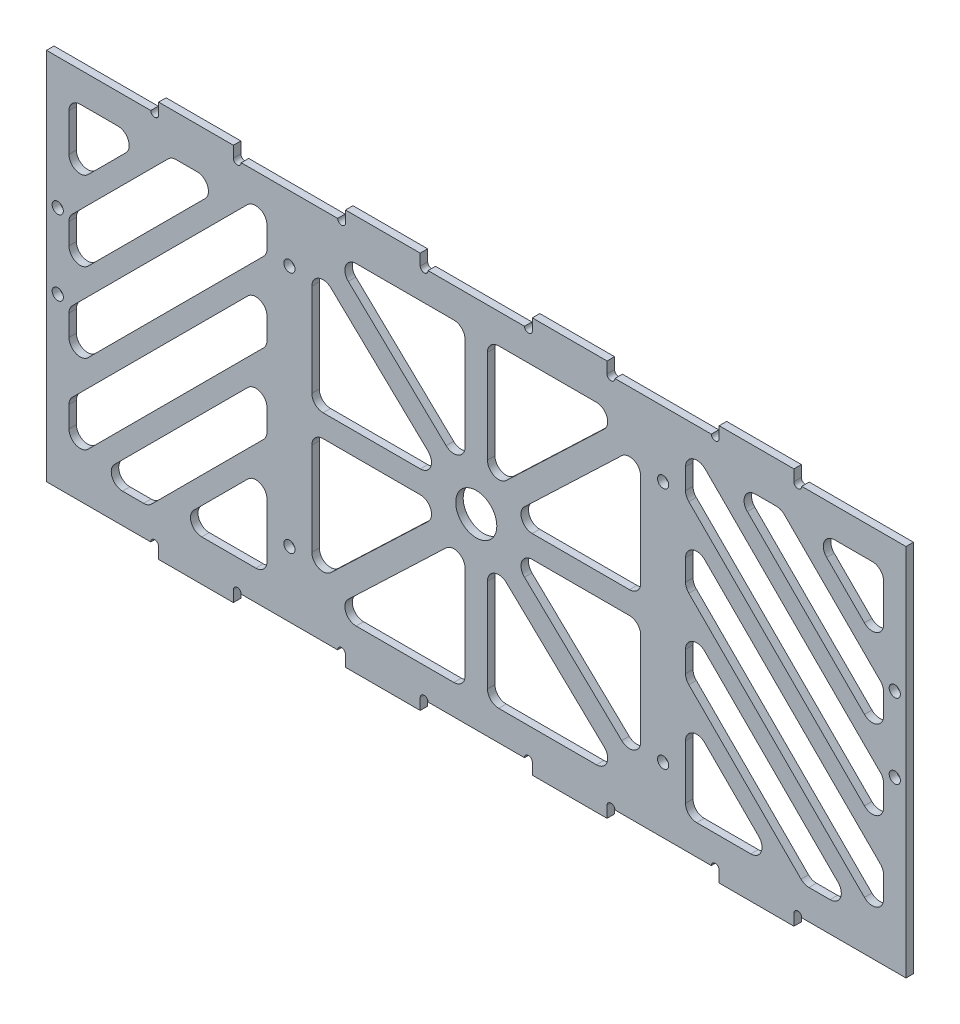
from build123d import *

# Parameters (mm, degrees)
SKETCH_1_W           = 230
SKETCH_1_H           = 100
EXTRUDE_1_DEPTH      = 2
SKETCH_5_R           = 1.5
CUT_EXTRUDE_3_DEPTH  = 2
SKETCH_6_W           = 70
SKETCH_6_H           = 6
EXTRUDE_3_DEPTH      = 2
SKETCH_7_R           = 1.05
CUT_EXTRUDE_4_DEPTH  = 2
SKETCH_10_W          = 20
SKETCH_10_H          = 6
EXTRUDE_5_DEPTH      = 2
SKETCH_11_R          = 1.05
CUT_EXTRUDE_6_DEPTH  = 2
SKETCH_14_W          = 30
SKETCH_14_H          = 6
CUT_EXTRUDE_9_DEPTH  = 2
SKETCH_15_R          = 1.05
CUT_EXTRUDE_10_DEPTH = 2
CUT_EXTRUDE_11_DEPTH = 40
CUT_EXTRUDE_12_DEPTH = 40
FILLET_1_R           = 3
SKETCH_18_R          = 5.5
CUT_EXTRUDE_13_DEPTH = 40
SKETCH_23_R          = 1.5
CUT_EXTRUDE_17_DEPTH = 10


with BuildPart() as part:
    # 草图1 → 凸台-拉伸1 (new body)
    with BuildSketch(Plane.XY):
        Rectangle(SKETCH_1_W, SKETCH_1_H)
    extrude(amount=EXTRUDE_1_DEPTH)

    # 草图5 → 切除-拉伸3 (cut)
    with BuildSketch(Plane(origin=(0, 0, 0), x_dir=(-1, 0, 0), z_dir=(0, 0, -1))):
        with Locations((50, -32.5)):
            Circle(SKETCH_5_R)
        with Locations((50, 32.5)):
            Circle(SKETCH_5_R)
        with Locations((-50, -32.5)):
            Circle(SKETCH_5_R)
        with Locations((-50, 32.5)):
            Circle(SKETCH_5_R)
    extrude(amount=-CUT_EXTRUDE_3_DEPTH, mode=Mode.SUBTRACT)

    # 草图6 → 凸台-拉伸3 (add)
    with BuildSketch(Plane.XY.offset(2)):
        with Locations((0, 50)):
            Rectangle(SKETCH_6_W, SKETCH_6_H)
        with Locations((0, -50)):
            Rectangle(SKETCH_6_W, SKETCH_6_H)
    extrude(amount=-EXTRUDE_3_DEPTH)

    # 草图7 → 切除-拉伸4 (cut)
    with BuildSketch(Plane.XY.offset(2)):
        with Locations((36.05, 50)):
            Circle(SKETCH_7_R)
        with Locations((-36.05, 50)):
            Circle(SKETCH_7_R)
        with Locations((-36.05, -50)):
            Circle(SKETCH_7_R)
        with Locations((36.05, -50)):
            Circle(SKETCH_7_R)
    extrude(amount=-CUT_EXTRUDE_4_DEPTH, mode=Mode.SUBTRACT)

    # 草图10 → 凸台-拉伸5 (add)
    with BuildSketch(Plane(origin=(0, 0, 0), x_dir=(-1, 0, 0), z_dir=(0, 0, -1))):
        with Locations((-75, 50)):
            Rectangle(SKETCH_10_W, SKETCH_10_H)
        with Locations((-75, -50)):
            Rectangle(SKETCH_10_W, SKETCH_10_H)
    extrude_5 = extrude(amount=-EXTRUDE_5_DEPTH)

    # 镜向3: 凸台-拉伸5 across plane
    add(extrude_5.mirror(Plane(origin=(0, 0, 0), x_dir=(0, 0, 1), z_dir=(1, 0, 0))))

    # 草图11 → 切除-拉伸6 (cut)
    with BuildSketch(Plane(origin=(0, 0, 0), x_dir=(-1, 0, 0), z_dir=(0, 0, -1))):
        with Locations((-63.95, 50)):
            Circle(SKETCH_11_R)
        with Locations((-86.05, 50)):
            Circle(SKETCH_11_R)
        with Locations((-86.05, -50)):
            Circle(SKETCH_11_R)
        with Locations((-63.95, -50)):
            Circle(SKETCH_11_R)
        with Locations((63.95, -50)):
            Circle(SKETCH_11_R)
        with Locations((86.05, -50)):
            Circle(SKETCH_11_R)
        with Locations((86.05, 50)):
            Circle(SKETCH_11_R)
        with Locations((63.95, 50)):
            Circle(SKETCH_11_R)
    extrude(amount=-CUT_EXTRUDE_6_DEPTH, mode=Mode.SUBTRACT)

    # 草图14 → 切除-拉伸9 (cut)
    with BuildSketch(Plane(origin=(0, 0, 0), x_dir=(-1, 0, 0), z_dir=(0, 0, -1))):
        with Locations((0, 53)):
            Rectangle(SKETCH_14_W, SKETCH_14_H)
    cut_extrude_9 = extrude(amount=-CUT_EXTRUDE_9_DEPTH, mode=Mode.SUBTRACT)

    # 镜向4: 切除-拉伸9 across plane
    add(cut_extrude_9.mirror(Plane.ZX), mode=Mode.SUBTRACT)

    # 草图15 → 切除-拉伸10 (cut)
    with BuildSketch(Plane(origin=(0, 0, 0), x_dir=(-1, 0, 0), z_dir=(0, 0, -1))):
        with Locations((-13.95, 50)):
            Circle(SKETCH_15_R)
        with Locations((-13.95, -50)):
            Circle(SKETCH_15_R)
        with Locations((13.95, -50)):
            Circle(SKETCH_15_R)
        with Locations((13.95, 50)):
            Circle(SKETCH_15_R)
    extrude(amount=-CUT_EXTRUDE_10_DEPTH, mode=Mode.SUBTRACT)

    # 草图16 → 切除-拉伸11 (cut)
    with BuildSketch(Plane.XY.offset(2)):
        Polygon((-39.655169621, -42), (-3, -42), (-3, -7.010974452), align=None)
        Polygon((-44, -3), (-44, -37.852661911), (-7.487687522, -3), align=None)
        Polygon((-44, 37.852661911), (-44, 3), (-7.487687522, 3), align=None)
        Polygon((-39.655169621, 42), (-3, 7.010974452), (-3, 42), align=None)
        Polygon((3, 42), (3, 7.010974452), (39.655169621, 42), align=None)
        Polygon((7.487687522, 3), (44, 3), (44, 37.852661911), align=None)
        Polygon((7.487687522, -3), (44, -37.852661911), (44, -3), align=None)
        Polygon((3, -7.010974452), (3, -42), (39.655169621, -42), align=None)
    extrude(amount=-CUT_EXTRUDE_11_DEPTH, mode=Mode.SUBTRACT)

    # 草图17 → 切除-拉伸12 (cut)
    with BuildSketch(Plane.XY.offset(2)):
        Polygon((-56, -17.284271247), (-80.715728753, -42), (-56, -42), align=None)
        Polygon((-56, 3.928932188), (-101.928932188, -42), (-87.786796564, -42), (-56, -10.213203436), align=None)
        Polygon((-56, 25.142135624), (-109, -27.857864376), (-109, -42), (-56, 11), align=None)
        Polygon((-56, 42), (-60.355339059, 42), (-109, -6.644660941), (-109, -20.786796564), (-56, 32.213203436), align=None)
        Polygon((-67.426406871, 42), (-81.568542495, 42), (-109, 14.568542495), (-109, 0.426406871), align=None)
        Polygon((-88.639610307, 42), (-109, 42), (-109, 21.639610307), align=None)
        Polygon((56, -42), (80.715728753, -42), (56, -17.284271247), align=None)
        Polygon((87.786796564, -42), (101.928932188, -42), (56, 3.928932188), (56, -10.213203436), align=None)
        Polygon((109, -42), (109, -27.857864376), (56, 25.142135624), (56, 11), align=None)
        Polygon((109, -6.644660941), (60.355339059, 42), (56, 42), (56, 32.213203436), (109, -20.786796564), align=None)
        Polygon((109, 14.568542495), (81.568542495, 42), (67.426406871, 42), (109, 0.426406871), align=None)
        Polygon((109, 42), (88.639610307, 42), (109, 21.639610307), align=None)
    extrude(amount=-CUT_EXTRUDE_12_DEPTH, mode=Mode.SUBTRACT)

    # 圆角1
    fillet_1_edges = [part.edges().sort_by_distance(p)[0] for p in [
        (3, 42, 1),
        (39.655169621, 42, 1),
        (3, 7.010974452, 1),
        (-39.655169621, 42, 1),
        (-3, 42, 1),
        (-3, 7.010974452, 1),
        (-44, 3, 1),
        (-44, 37.852661911, 1),
        (-7.487687522, 3, 1),
        (-44, -3, 1),
        (-7.487687522, -3, 1),
        (-44, -37.852661911, 1),
        (3, -7.010974452, 1),
        (39.655169621, -42, 1),
        (3, -42, 1),
        (7.487687522, -3, 1),
        (44, -3, 1),
        (44, -37.852661911, 1),
        (7.487687522, 3, 1),
        (44, 37.852661911, 1),
        (44, 3, 1),
        (-3, -7.010974452, 1),
        (-3, -42, 1),
        (-39.655169621, -42, 1),
        (-88.639610307, 42, 1),
        (-109, 21.639610307, 1),
        (-109, 42, 1),
        (56, -17.284271247, 1),
        (80.715728753, -42, 1),
        (56, -42, 1),
        (56, 25.142135624, 1),
        (109, -27.857864376, 1),
        (109, -42, 1),
        (56, 11, 1),
        (56, 3.928932188, 1),
        (101.928932188, -42, 1),
        (87.786796564, -42, 1),
        (56, -10.213203436, 1),
        (-109, -27.857864376, 1),
        (-56, 25.142135624, 1),
        (-56, 11, 1),
        (-109, -42, 1),
        (-56, -10.213203436, 1),
        (-87.786796564, -42, 1),
        (-101.928932188, -42, 1),
        (-56, 3.928932188, 1),
        (-81.568542495, 42, 1),
        (-67.426406871, 42, 1),
        (-109, 0.426406871, 1),
        (-109, 14.568542495, 1),
        (-60.355339059, 42, 1),
        (-56, 42, 1),
        (-56, 32.213203436, 1),
        (-109, -20.786796564, 1),
        (-109, -6.644660941, 1),
        (109, 42, 1),
        (109, 21.639610307, 1),
        (88.639610307, 42, 1),
        (60.355339059, 42, 1),
        (109, -6.644660941, 1),
        (109, -20.786796564, 1),
        (56, 32.213203436, 1),
        (56, 42, 1),
        (81.568542495, 42, 1),
        (109, 14.568542495, 1),
        (109, 0.426406871, 1),
        (67.426406871, 42, 1),
        (-56, -17.284271247, 1),
        (-56, -42, 1),
        (-80.715728753, -42, 1),
    ]]
    fillet(fillet_1_edges, radius=FILLET_1_R)

    # 草图18 → 切除-拉伸13 (cut)
    with BuildSketch(Plane.XY.offset(2)):
        Circle(SKETCH_18_R)
    extrude(amount=-CUT_EXTRUDE_13_DEPTH, mode=Mode.SUBTRACT)

    # 草图23 → 切除-拉伸17 (cut)
    with BuildSketch(Plane.XY.offset(2)):
        with Locations((112, 15)):
            Circle(SKETCH_23_R)
        with Locations((112, -5)):
            Circle(SKETCH_23_R)
    cut_extrude_17 = extrude(amount=-CUT_EXTRUDE_17_DEPTH, mode=Mode.SUBTRACT)

    # 镜向5: 切除-拉伸17 across plane
    add(cut_extrude_17.mirror(Plane(origin=(0, 0, 0), x_dir=(0, 0, 1), z_dir=(1, 0, 0))), mode=Mode.SUBTRACT)


solid = part.part
